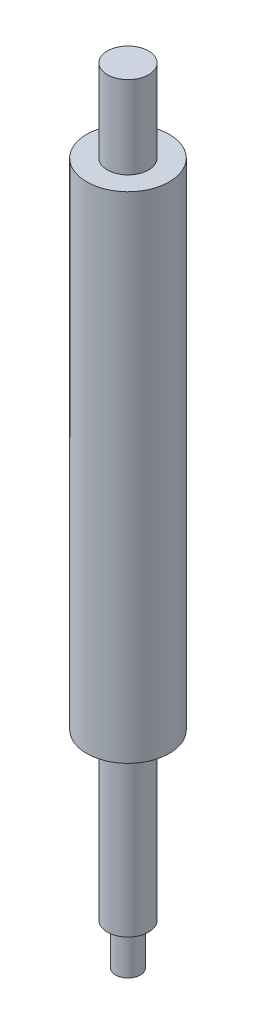
from build123d import *


with BuildPart() as part:
    # Esquisse1 → Révolution1 (revolve)
    with BuildSketch(Plane.XY, mode=Mode.PRIVATE) as r_volution1_sk:
        Polygon((2.5, 5), (1.5, 5), (1.5, 0), (0, 0), (0, 95), (2.5, 95), (2.5, 85), (5, 85), (5, 25), (2.5, 25), align=None)
    revolve(r_volution1_sk.sketch.rotate(Axis((0, 95, 0), (0, -1, 0)), 180), axis=Axis((0, 95, 0), (0, -1, 0)))


solid = part.part
